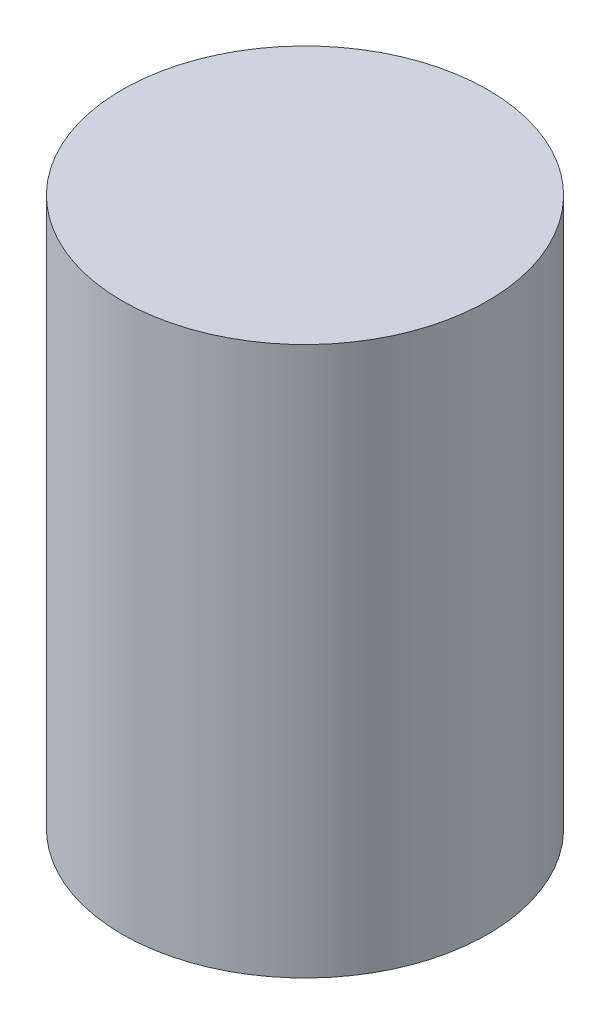
from build123d import *

# Parameters (mm, degrees)
SKETCH2_R           = 2
BOSS_EXTRUDE1_DEPTH = 6


with BuildPart() as part:
    # Sketch2 → Boss-Extrude1 (new body)
    with BuildSketch(Plane(origin=(0, 0, 0), x_dir=(1, 0, 0), z_dir=(0, 1, 0))):
        with Locations(Location((0, 0, 0), (0, 0, 270))):
            Circle(SKETCH2_R)
    extrude(amount=BOSS_EXTRUDE1_DEPTH)


solid = part.part
